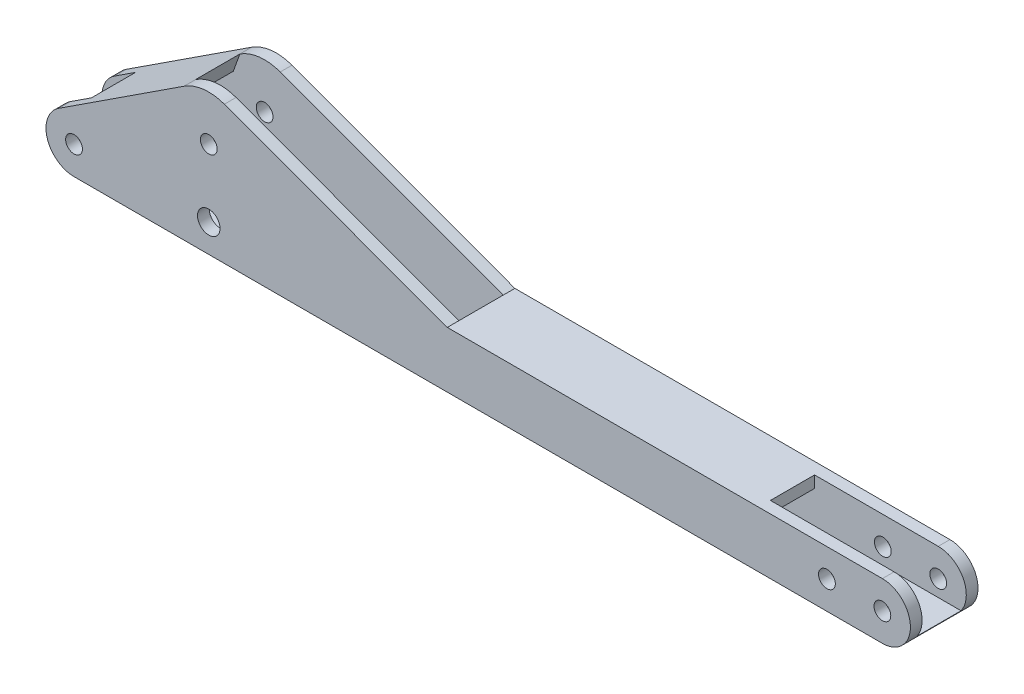
from build123d import *

# Parameters (mm, degrees)
SKETCH1_R           = 38
SKETCH1_R_2         = 51
BOSS_EXTRUDE1_DEPTH = 153
CUT_EXTRUDE1_DEPTH  = 100


with BuildPart() as part:
    # Sketch1 → Boss-Extrude1 (new, symmetric)
    with BuildSketch(Plane.XY):
        with BuildLine():
            Line((-69.41492259, 106.351156655), (497.952290308, 476.669189876))
            ThreePointArc((497.952290308, 476.669189876), (586.831228911, 508.686543606), (680.630369154, 497.448307224))
            Line((680.630369154, 497.448307224), (1690, 127))
            Line((1690, 127), (3660, 127))
            ThreePointArc((3660, 127), (3787, 0), (3660, -127))
            Line((3660, -127), (0, -127))
            ThreePointArc((0, -127), (-121.728379795, -36.210517152), (-69.41492259, 106.351156655))
        make_face()
        Circle(SKETCH1_R, mode=Mode.SUBTRACT)
        with Locations((610, 0)):
            Circle(SKETCH1_R_2, mode=Mode.SUBTRACT)
        with Locations((610, 305)):
            Circle(SKETCH1_R, mode=Mode.SUBTRACT)
        with Locations((3409, 0)):
            Circle(SKETCH1_R, mode=Mode.SUBTRACT)
        with Locations((3660, 0)):
            Circle(SKETCH1_R, mode=Mode.SUBTRACT)
    extrude(amount=BOSS_EXTRUDE1_DEPTH, both=True)

    # Sketch2 → Cut-Extrude1 (cut, symmetric)
    with BuildSketch(Plane.XY):
        Polygon((54.468432262, 123.918934439), (25.5, 168.301700602), (25.5, 441.704225578), (-335.578738739, 441.704225578), (-335.578738739, -282.733576461), (218.242094516, -282.733576461), (218.242094516, -127), (299.443817322, -74), (3763.213371227, -74), (4168.773290142, -74), (4168.773290142, 728.333745917), (3100, 728.333745917), (3100, 127), (3100, 74), (1670.548493156, 74), (1690, 127), (1690, 728.333745917), (497.952290308, 728.333745917), (497.952290308, 476.669189876), (468.104782812, 393.897523829), align=None)
    extrude(amount=CUT_EXTRUDE1_DEPTH, both=True, mode=Mode.SUBTRACT)


solid = part.part
